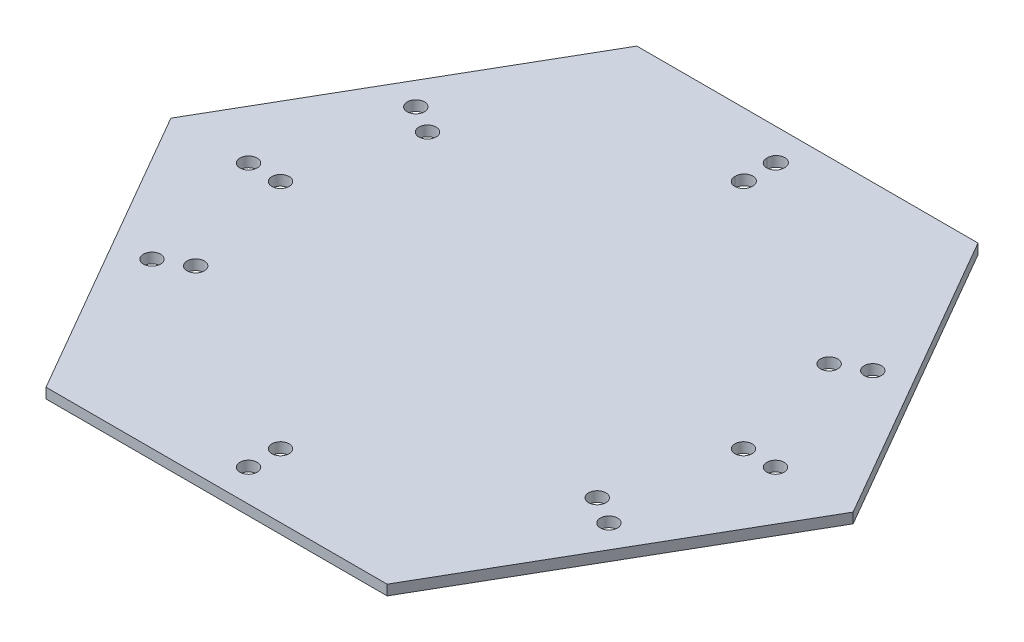
from build123d import *

# Parameters (mm, degrees)
BOSS_EXTRUDE1_DEPTH = 4.78
SKETCH2_R           = 4.05
CUT_EXTRUDE1_DEPTH  = 4.78
CIRPATTERN1_COUNT   = 6
CIRPATTERN2_COUNT   = 4


with BuildPart() as part:
    # Sketch1 → Boss-Extrude1 (new body)
    with BuildSketch(Plane(origin=(0, 0, 0), x_dir=(1, 0, 0), z_dir=(0, 1, 0))):
        Polygon((160, 0), (80, 138.564064606), (-80, 138.564064606), (-160, 0), (-80, -138.564064606), (80, -138.564064606), align=None)
    extrude(amount=BOSS_EXTRUDE1_DEPTH)

    # Sketch2 → Cut-Extrude1 (cut)
    with BuildSketch(Plane(origin=(0, 4.78, 0), x_dir=(1, 0, 0), z_dir=(0, 1, 0))):
        with Locations(Location((0, -123.564064606, 0), (0, 0, 270))):
            Circle(SKETCH2_R)
        with Locations(Location((0, -108.564064606, 0), (0, 0, 270))):
            Circle(SKETCH2_R)
    cut_extrude1 = extrude(amount=-CUT_EXTRUDE1_DEPTH, mode=Mode.SUBTRACT)

    # CirPattern1: Cut-Extrude1 ×6 about axis
    cirpattern1_axis = Axis((0, 0, -0.180123057), (0, 1, 0))
    for i in range(1, CIRPATTERN1_COUNT):
        add(cut_extrude1.rotate(cirpattern1_axis, i * 360 / CIRPATTERN1_COUNT), mode=Mode.SUBTRACT)

    # CirPattern2: Cut-Extrude1 ×4 about axis
    cirpattern2_axis = Axis((0, 0, 0.001690344), (0, 1, 0))
    for i in range(1, CIRPATTERN2_COUNT):
        add(cut_extrude1.rotate(cirpattern2_axis, i * 360 / CIRPATTERN2_COUNT), mode=Mode.SUBTRACT)


solid = part.part
